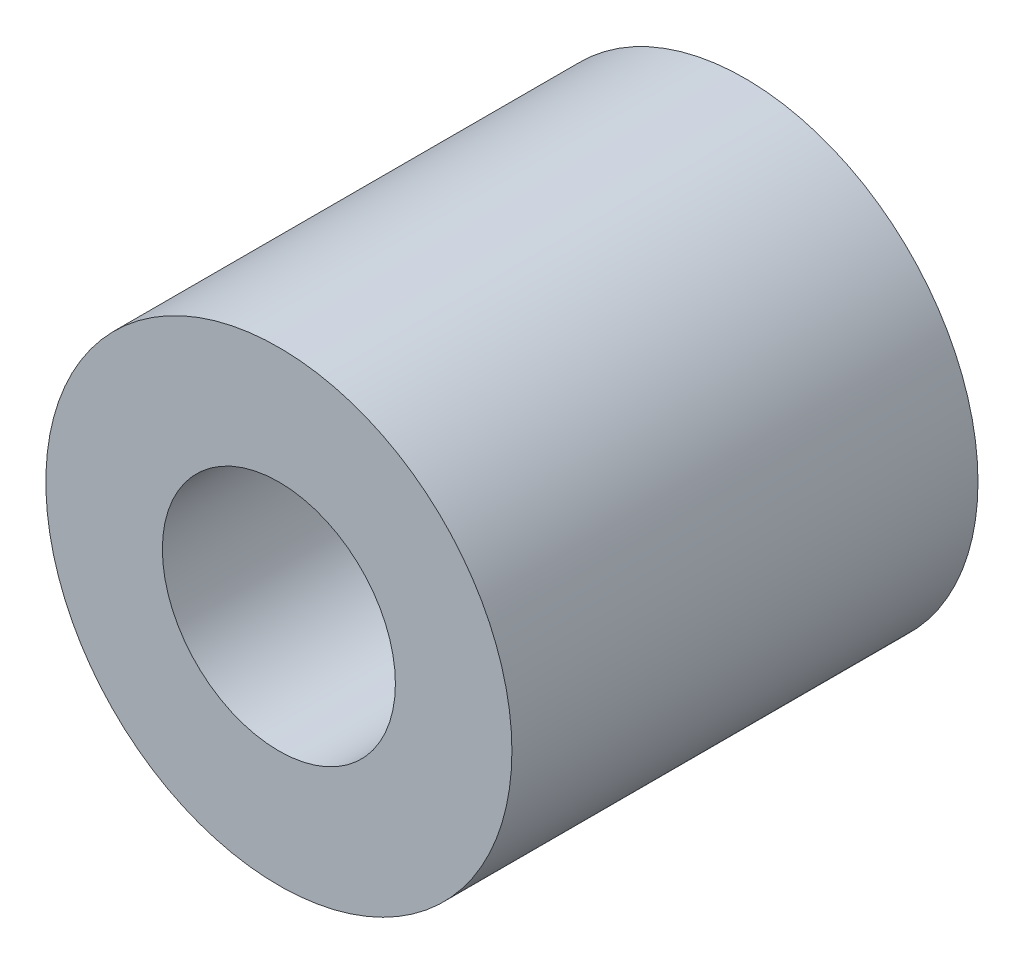
from build123d import *

# Parameters (mm, degrees)
SKETCH1_R           = 12.7
SKETCH1_R_2         = 6.35
BOSS_EXTRUDE1_DEPTH = 25.4


with BuildPart() as part:
    # Sketch1 → Boss-Extrude1 (new body)
    with BuildSketch(Plane.XY):
        Circle(SKETCH1_R)
        Circle(SKETCH1_R_2, mode=Mode.SUBTRACT)
    extrude(amount=BOSS_EXTRUDE1_DEPTH)


solid = part.part
